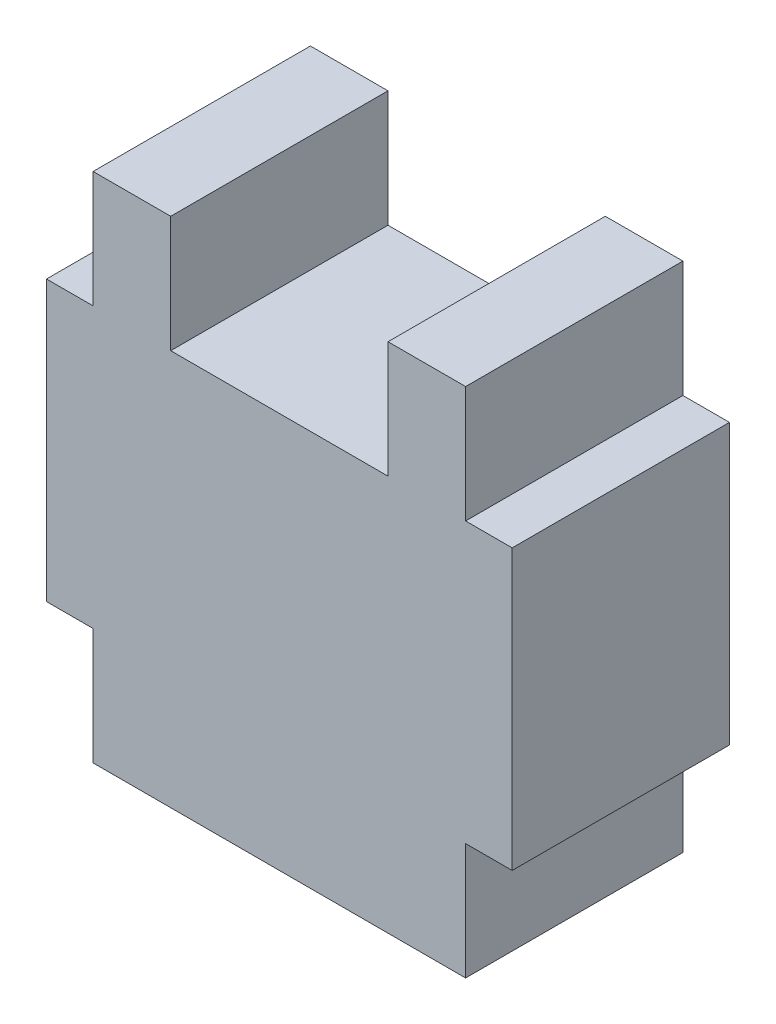
from build123d import *

# Parameters (mm, degrees)
COMPONENT_OUTLINE_DEPTH = 1.4


with BuildPart() as part:
    # 草图1 → Component_Outline (new body)
    with BuildSketch(Plane.XY):
        Polygon((-1.2, -1.65), (-1.2, -0.9), (-1.5, -0.9), (-1.5, 0.9), (-1.2, 0.9), (-1.2, 1.65), (-0.7, 1.65), (-0.7, 0.9), (0.7, 0.9), (0.7, 1.65), (1.2, 1.65), (1.2, 0.9), (1.5, 0.9), (1.5, -0.9), (1.2, -0.9), (1.2, -1.65), align=None)
    extrude(amount=COMPONENT_OUTLINE_DEPTH)


solid = part.part
